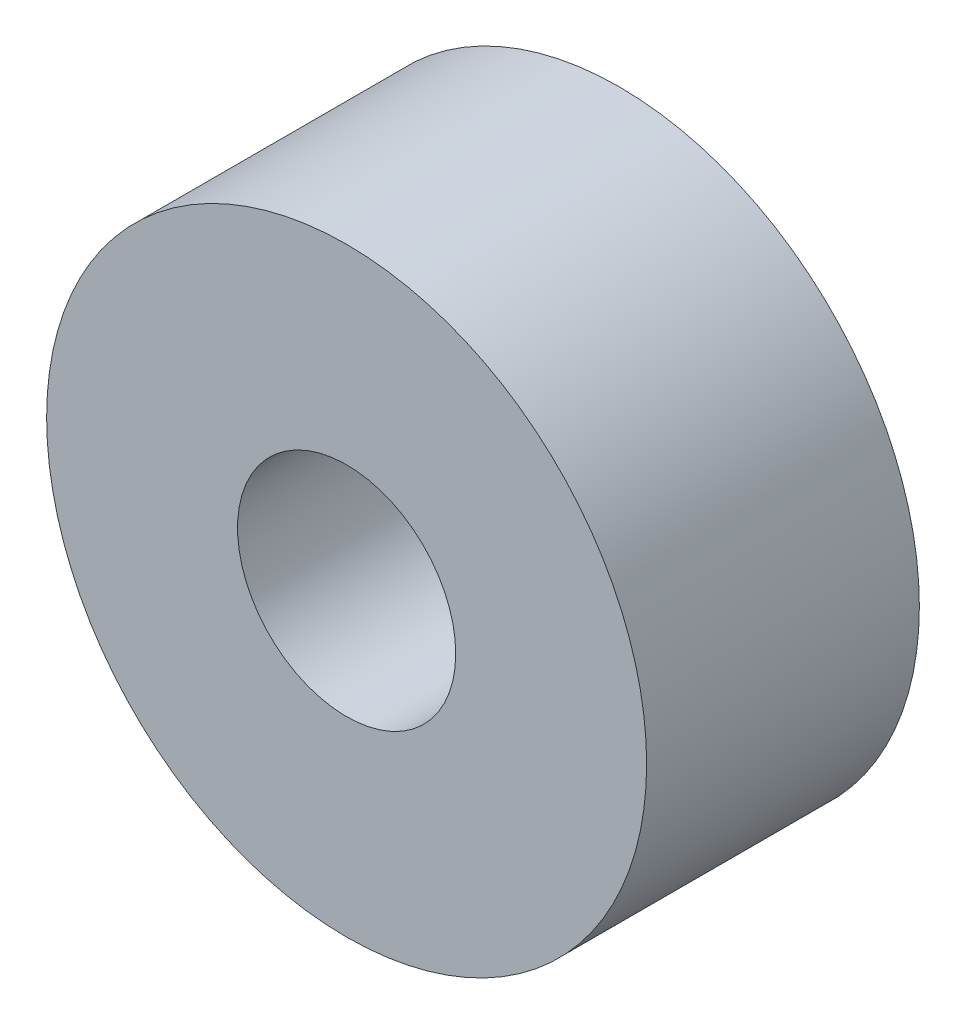
from build123d import *

# Parameters (mm, degrees)
SKETCH1_R           = 8.73125
SKETCH1_R_2         = 3.175
BOSS_EXTRUDE1_DEPTH = 7.9375


with BuildPart() as part:
    # Sketch1 → Boss-Extrude1 (new body)
    with BuildSketch(Plane.XY):
        Circle(SKETCH1_R)
        Circle(SKETCH1_R_2, mode=Mode.SUBTRACT)
    extrude(amount=BOSS_EXTRUDE1_DEPTH)


solid = part.part
